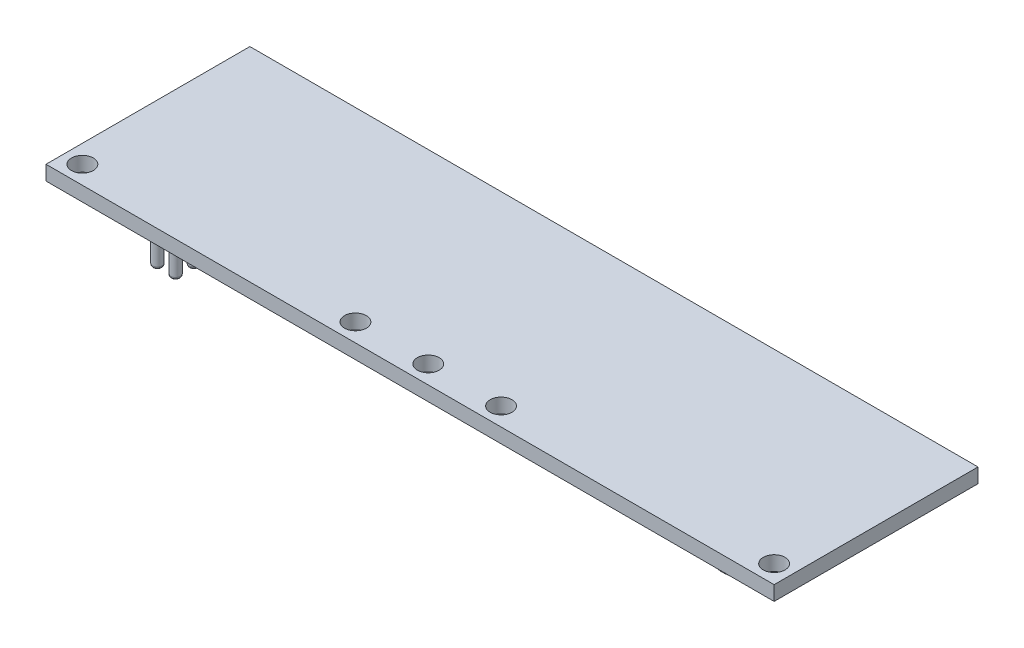
from build123d import *

# Parameters (mm, degrees)
SKETCH1_W              = 100
SKETCH1_H              = 28
BOARD_DEPTH            = 2
SCREW_HOLES_DEPTH      = 104.865297381
SCREW_HOLES_DEPTH_BACK = 104.865297381
SKETCH4_R              = 1.5
SKETCH6_W              = 5
SKETCH6_H              = 8
PIN_BASE_DEPTH         = 1.5
SKETCH7_R              = 0.65
PINS_DEPTH             = 10
PINS_2_DEPTH           = 10
PINS_3_DEPTH           = 10
PINS_4_DEPTH           = 10
PINS_5_DEPTH           = 10
PINS_6_DEPTH           = 10
FILLET1_R              = 0.4
FILLET2_R              = 0.4
FILLET3_R              = 0.4
FILLET4_R              = 0.4
FILLET5_R              = 0.4
FILLET6_R              = 0.4
GND_DEPTH              = 0.1
GND_2_DEPTH            = 0.1
GND_3_DEPTH            = 0.1
GND_4_DEPTH            = 0.1
GND_5_DEPTH            = 0.1
GND_6_DEPTH            = 0.1
EXTRUDE_5V_DEPTH       = 0.1
EXTRUDE_5V_2_DEPTH     = 0.1
EXTRUDE_5V_3_DEPTH     = 0.1
EXTRUDE_5V_4_DEPTH     = 0.1
SLC_SDA_DEPTH          = 0.1
SLC_SDA_2_DEPTH        = 0.1
SLC_SDA_3_DEPTH        = 0.1
SLC_SDA_4_DEPTH        = 0.1
SLC_SDA_5_DEPTH        = 0.1
SLC_SDA_6_DEPTH        = 0.1
SKETCH11_W             = 10
SKETCH11_H             = 10
BOSS_EXTRUDE7_DEPTH    = 5
SKETCH12_R             = 4.583408203
BOSS_EXTRUDE8_DEPTH    = 5


with BuildPart() as part:
    # Sketch1 → BOARD (new body)
    with BuildSketch(Plane(origin=(0, 0, 0), x_dir=(1, 0, 0), z_dir=(0, 1, 0))):
        with Locations((50, 14)):
            Rectangle(SKETCH1_W, SKETCH1_H)
    extrude(amount=BOARD_DEPTH)

    # Sketch4 → SCREW HOLES (cut, two sides: drawn at the far end of the back side and taken through both)
    with BuildSketch(Plane(origin=(0, 0, 0), x_dir=(1, 0, 0), z_dir=(0, 1, 0)).offset(-SCREW_HOLES_DEPTH_BACK)):
        with Locations(Location((2.5, 2.5, 0), (0, 0, 90))):
            Circle(SKETCH4_R)
        with Locations(Location((40, 2.5, 0), (0, 0, 90))):
            Circle(SKETCH4_R)
        with Locations(Location((50, 2.5, 0), (0, 0, 90))):
            Circle(SKETCH4_R)
        with Locations(Location((60, 2.5, 0), (0, 0, 90))):
            Circle(SKETCH4_R)
        with Locations(Location((97.5, 2.5, 0), (0, 0, 90))):
            Circle(SKETCH4_R)
    extrude(amount=SCREW_HOLES_DEPTH + SCREW_HOLES_DEPTH_BACK, mode=Mode.SUBTRACT)


with BuildPart() as body_2:
    # Sketch6 → PIN BASE (new body)
    with BuildSketch(Plane.XZ):
        with Locations((7.5, -11.5)):
            Rectangle(SKETCH6_W, SKETCH6_H)
    extrude(amount=PIN_BASE_DEPTH)


with BuildPart() as body_3:
    # Sketch7 → PINS (new body)
    with BuildSketch(Plane.XZ.offset(1.5)):
        with Locations(Location((6.3, -9, 0), (0, 0, 270))):
            Circle(SKETCH7_R)
    extrude(amount=PINS_DEPTH)

    # Fillet1
    fillet1_edges = [body_3.edges().sort_by_distance(p)[0] for p in [
        (6.3, -11.5, -8.35),
    ]]
    fillet(fillet1_edges, radius=FILLET1_R)


with BuildPart() as body_4:
    # Sketch7 → PINS 2 (new body)
    with BuildSketch(Plane.XZ.offset(1.5)):
        with Locations(Location((8.8, -9, 0), (0, 0, 270))):
            Circle(SKETCH7_R)
    extrude(amount=PINS_2_DEPTH)

    # Fillet3
    fillet3_edges = [body_4.edges().sort_by_distance(p)[0] for p in [
        (8.8, -11.5, -8.35),
    ]]
    fillet(fillet3_edges, radius=FILLET3_R)


with BuildPart() as body_5:
    # Sketch7 → PINS 3 (new body)
    with BuildSketch(Plane.XZ.offset(1.5)):
        with Locations(Location((8.8, -11.5, 0), (0, 0, 270))):
            Circle(SKETCH7_R)
    extrude(amount=PINS_3_DEPTH)

    # Fillet4
    fillet4_edges = [body_5.edges().sort_by_distance(p)[0] for p in [
        (8.8, -11.5, -10.85),
    ]]
    fillet(fillet4_edges, radius=FILLET4_R)


with BuildPart() as body_6:
    # Sketch7 → PINS 4 (new body)
    with BuildSketch(Plane.XZ.offset(1.5)):
        with Locations(Location((8.8, -14, 0), (0, 0, 270))):
            Circle(SKETCH7_R)
    extrude(amount=PINS_4_DEPTH)

    # Fillet6
    fillet6_edges = [body_6.edges().sort_by_distance(p)[0] for p in [
        (8.8, -11.5, -13.35),
    ]]
    fillet(fillet6_edges, radius=FILLET6_R)


with BuildPart() as body_7:
    # Sketch7 → PINS 5 (new body)
    with BuildSketch(Plane.XZ.offset(1.5)):
        with Locations(Location((6.3, -11.5, 0), (0, 0, 270))):
            Circle(SKETCH7_R)
    extrude(amount=PINS_5_DEPTH)

    # Fillet2
    fillet2_edges = [body_7.edges().sort_by_distance(p)[0] for p in [
        (6.3, -11.5, -10.85),
    ]]
    fillet(fillet2_edges, radius=FILLET2_R)


with BuildPart() as body_8:
    # Sketch7 → PINS 6 (new body)
    with BuildSketch(Plane.XZ.offset(1.5)):
        with Locations(Location((6.3, -14, 0), (0, 0, 270))):
            Circle(SKETCH7_R)
    extrude(amount=PINS_6_DEPTH)

    # Fillet5
    fillet5_edges = [body_8.edges().sort_by_distance(p)[0] for p in [
        (6.3, -11.5, -13.35),
    ]]
    fillet(fillet5_edges, radius=FILLET5_R)


with BuildPart() as body_9:
    # Sketch8 → gnd (new body)
    with BuildSketch(Plane.XZ):
        with BuildLine():
            Line((1.843758536, -6.912470807), (1.741995715, -7.008933481))
            add(Edge.make_bspline(
                [(1.741995715, -7.008933481), (1.723581135, -6.991610506), (1.687191082, -6.957377632), (1.627863847, -6.912961274), (1.565965093, -6.874911885), (1.50181781, -6.843953278), (1.437010559, -6.81925149), (1.372403551, -6.801664961), (1.308659491, -6.790449448), (1.266262953, -6.789108249), (1.24537195, -6.78844737)],
                knots=[0, 0, 0, 0, 1.08915593, 2.152340314, 3.188132944, 4.216796309, 5.218260357, 6.173443236, 7.099959455, 8, 8, 8, 8], degree=3))
            add(Edge.make_bspline(
                [(1.24537195, -6.78844737), (1.232553001, -6.788603703), (1.20694835, -6.788915964), (1.168915651, -6.792901426), (1.131281832, -6.798633384), (1.094117938, -6.806926891), (1.057351707, -6.817438053), (1.021111013, -6.83058613), (0.985328251, -6.845915047), (0.950340476, -6.863627946), (0.916420703, -6.883086103), (0.884384637, -6.904649093), (0.854028084, -6.927625808), (0.825921614, -6.952591505), (0.799903552, -6.979320041), (0.775354614, -7.007314207), (0.753138196, -7.037338828), (0.733071, -7.068841491), (0.715169435, -7.101268896), (0.69936676, -7.134308924), (0.686100896, -7.167851988), (0.675604703, -7.201940178), (0.666945022, -7.236309776), (0.66085295, -7.271198763), (0.657418385, -7.306644495), (0.65682429, -7.330380364), (0.65652563, -7.342312721)],
                knots=[0, 0, 0, 0, 1.02818874, 2.053710826, 3.065248034, 4.081641283, 5.106893873, 6.131558223, 7.173050175, 8.228653731, 9.27666206, 10.308777013, 11.325269123, 12.329503258, 13.32196095, 14.316845687, 15.314881793, 16.315733098, 17.311955233, 18.285320748, 19.252783886, 20.203351036, 21.145449891, 22.095197417, 23.042428769, 24, 24, 24, 24], degree=3))
            add(Edge.make_bspline(
                [(0.65652563, -7.342312721), (0.656811273, -7.354510322), (0.65738178, -7.378872215), (0.661033151, -7.415231284), (0.667809599, -7.45105035), (0.676868822, -7.486447115), (0.688200857, -7.521482199), (0.702326835, -7.556003714), (0.719058178, -7.590010379), (0.738424374, -7.623195788), (0.759661422, -7.655521455), (0.783452408, -7.685971036), (0.808724116, -7.714950008), (0.836397227, -7.741814955), (0.865584376, -7.767284463), (0.897157587, -7.790656818), (0.930496017, -7.812382218), (0.965650529, -7.832186855), (1.002239676, -7.849879367), (1.039756365, -7.865612208), (1.07832045, -7.878568982), (1.117729264, -7.88912892), (1.157935828, -7.897784687), (1.19914423, -7.903353214), (1.241051474, -7.907394093), (1.269300897, -7.907689546), (1.283533008, -7.907838395)],
                knots=[0, 0, 0, 0, 0.93586088, 1.869166235, 2.799637598, 3.729985548, 4.670839027, 5.622275134, 6.589130586, 7.576015415, 8.568469353, 9.55398029, 10.53834874, 11.515998671, 12.510579167, 13.508179873, 14.527009472, 15.561807829, 16.601455013, 17.643573243, 18.680854198, 19.719860599, 20.772568776, 21.833555941, 22.908541556, 24, 24, 24, 24], degree=3))
            add(Edge.make_bspline(
                [(1.283533008, -7.907838395), (1.300684943, -7.907479856), (1.334365553, -7.906775806), (1.38387531, -7.901295042), (1.431425876, -7.892735093), (1.476883637, -7.880199174), (1.520301392, -7.864209392), (1.561838307, -7.84493435), (1.601167357, -7.821634741), (1.63840677, -7.795337476), (1.672710826, -7.766038715), (1.703649736, -7.734423103), (1.730730025, -7.700644101), (1.754355313, -7.664900664), (1.773899953, -7.626896932), (1.789942319, -7.586819148), (1.802239129, -7.544649285), (1.807286991, -7.515510484), (1.809837595, -7.500787113)],
                knots=[0, 0, 0, 0, 1.13008108, 2.219097802, 3.278683437, 4.311054135, 5.322181354, 6.324827112, 7.324222904, 8.330512327, 9.32562643, 10.293043162, 11.24128371, 12.174520618, 13.111833804, 14.052305215, 15.015860969, 16, 16, 16, 16], degree=3))
            Line((1.809837595, -7.500787113), (1.368865373, -7.500787113))
            Line((1.368865373, -7.500787113), (1.368865373, -7.365103353))
            Line((1.368865373, -7.365103353), (1.928560886, -7.365103353))
            add(Edge.make_bspline(
                [(1.928560886, -7.365103353), (1.927916116, -7.39039279), (1.926654184, -7.439888788), (1.917802392, -7.512071004), (1.903508651, -7.580247209), (1.883982283, -7.644489204), (1.858705019, -7.704705949), (1.827948141, -7.760958583), (1.791219393, -7.812883697), (1.749827053, -7.860905195), (1.703373795, -7.903740939), (1.653114823, -7.941389612), (1.5989671, -7.973102803), (1.540981845, -7.998903708), (1.479348884, -8.01904001), (1.413925597, -8.033316767), (1.344800706, -8.041870354), (1.297426427, -8.042963227), (1.273197722, -8.043522156)],
                knots=[0, 0, 0, 0, 1.140356446, 2.231883559, 3.274166699, 4.278491846, 5.25512956, 6.21435461, 7.1637429, 8.11826594, 9.068280886, 10.0076534, 10.945064095, 11.891975133, 12.864533718, 13.863980011, 14.907571808, 16, 16, 16, 16], degree=3))
            add(Edge.make_bspline(
                [(1.273197722, -8.043522156), (1.258263831, -8.043307042), (1.228809386, -8.042882767), (1.185307756, -8.03986752), (1.14300556, -8.035225754), (1.101908961, -8.028216139), (1.06186679, -8.019630541), (1.02307903, -8.008636454), (0.985397925, -7.995910487), (0.948765234, -7.981435634), (0.913513456, -7.964664204), (0.879485576, -7.946026335), (0.846493499, -7.92561813), (0.814761958, -7.90308665), (0.784125618, -7.878600422), (0.754782025, -7.852110369), (0.726566905, -7.823697476), (0.708892563, -7.803521481), (0.699986834, -7.793355222)],
                knots=[0, 0, 0, 0, 1.107784379, 2.184907829, 3.233506516, 4.263428166, 5.276301166, 6.270063455, 7.25232949, 8.225834625, 9.190232166, 10.146266622, 11.1027726, 12.066435141, 13.031522626, 14.010570082, 14.99756817, 16, 16, 16, 16], degree=3))
            add(Edge.make_bspline(
                [(0.699986834, -7.793355222), (0.687065366, -7.777226732), (0.661436912, -7.745237466), (0.628447847, -7.693983916), (0.600325888, -7.640915355), (0.577508289, -7.585884052), (0.559691215, -7.528941481), (0.546913256, -7.470160404), (0.539426572, -7.409465127), (0.538348003, -7.368392244), (0.537802339, -7.347612868)],
                knots=[0, 0, 0, 0, 1.023165419, 2.029347347, 3.013907458, 3.994755782, 4.975994455, 5.96558838, 6.970761222, 8, 8, 8, 8], degree=3))
            add(Edge.make_bspline(
                [(0.537802339, -7.347612868), (0.538003512, -7.332053005), (0.538403302, -7.301131034), (0.543251042, -7.255223064), (0.55020634, -7.210130243), (0.560429482, -7.165889431), (0.573317059, -7.122471083), (0.589401263, -7.079855037), (0.608128054, -7.038016145), (0.629894001, -6.997242391), (0.654116401, -6.95807483), (0.680404728, -6.920671137), (0.709132279, -6.885712472), (0.739829918, -6.852756105), (0.772863899, -6.822216065), (0.807924753, -6.7938096), (0.845039498, -6.767498608), (0.8843249, -6.743697509), (0.92519459, -6.722317808), (0.967550602, -6.703574266), (1.011380008, -6.688083549), (1.056354441, -6.674939888), (1.10281433, -6.665220177), (1.150422524, -6.658171395), (1.199427179, -6.653348193), (1.232551512, -6.652960292), (1.249347061, -6.652763609)],
                knots=[0, 0, 0, 0, 1.008945113, 2.00506715, 2.99143336, 3.967273523, 4.948097931, 5.927297278, 6.919902385, 7.919676788, 8.923139349, 9.905703106, 10.883022732, 11.856032218, 12.825136022, 13.798837087, 14.781400844, 15.773989409, 16.776158564, 17.77167057, 18.775803737, 19.789618931, 20.80898985, 21.851988756, 22.910860228, 24, 24, 24, 24], degree=3))
            add(Edge.make_bspline(
                [(1.249347061, -6.652763609), (1.263044254, -6.652982643), (1.290204179, -6.653416962), (1.330619559, -6.656427409), (1.370410253, -6.661198936), (1.409635257, -6.667710251), (1.448160997, -6.676578967), (1.486097222, -6.68719189), (1.523498924, -6.699548621), (1.560248888, -6.714285477), (1.596594215, -6.731012293), (1.632736994, -6.749840581), (1.668553733, -6.771092294), (1.704106544, -6.794830535), (1.739619621, -6.820647601), (1.774531257, -6.849281876), (1.809684155, -6.879604168), (1.832287817, -6.90140666), (1.843758536, -6.912470807)],
                knots=[0, 0, 0, 0, 0.985871117, 1.954866573, 2.915460327, 3.869826059, 4.81536089, 5.759505086, 6.70452669, 7.649098992, 8.607881297, 9.583363685, 10.581137262, 11.603961102, 12.659522466, 13.73993555, 14.853081303, 16, 16, 16, 16], degree=3))
        make_face()
    extrude(amount=GND_DEPTH)


with BuildPart() as body_10:
    # Sketch8 → gnd 2 (new body)
    with BuildSketch(Plane.XZ):
        Polygon((2.199928407, -8.009601216), (2.199928407, -6.686684549), (2.224839098, -6.686684549), (3.098833322, -7.727898408), (3.098833322, -6.686684549), (3.217556612, -6.686684549), (3.217556612, -8.009601216), (3.190525863, -8.009601216), (2.318651698, -6.970772423), (2.318651698, -8.009601216), align=None)
    extrude(amount=GND_2_DEPTH)


with BuildPart() as body_11:
    # Sketch8 → gnd 3 (new body)
    with BuildSketch(Plane.XZ):
        with BuildLine():
            Line((3.556766014, -8.009601216), (3.556766014, -6.686684549))
            Line((3.556766014, -6.686684549), (3.823893418, -6.686684549))
            add(Edge.make_bspline(
                [(3.823893418, -6.686684549), (3.847127232, -6.68685183), (3.89201484, -6.687175016), (3.956880259, -6.689224173), (4.016896741, -6.692849141), (4.071866899, -6.698129289), (4.121941642, -6.704612727), (4.166980759, -6.712739368), (4.207217135, -6.722335492), (4.231963024, -6.730516957), (4.243665053, -6.734385871)],
                knots=[0, 0, 0, 0, 1.314313732, 2.53924729, 3.670748893, 4.714932338, 5.66265055, 6.526160246, 7.303039223, 8, 8, 8, 8], degree=3))
            add(Edge.make_bspline(
                [(4.243665053, -6.734385871), (4.2589711, -6.740218311), (4.289236104, -6.751750929), (4.332328082, -6.773505841), (4.372894514, -6.79815484), (4.411152941, -6.825730419), (4.446229444, -6.857013373), (4.479494333, -6.890674831), (4.509586803, -6.927938876), (4.537144403, -6.968032696), (4.561990917, -7.010483977), (4.583588158, -7.055211831), (4.601524638, -7.101989109), (4.61641434, -7.150685727), (4.628149161, -7.201408763), (4.636155427, -7.254217278), (4.641436129, -7.308902567), (4.641966827, -7.346010176), (4.6422361, -7.364838345)],
                knots=[0, 0, 0, 0, 0.984719456, 1.947108742, 2.898477687, 3.838006223, 4.779231079, 5.722358779, 6.681677486, 7.655904652, 8.64651281, 9.637519902, 10.640069247, 11.656948941, 12.698408672, 13.768548281, 14.867775369, 16, 16, 16, 16], degree=3))
            add(Edge.make_bspline(
                [(4.6422361, -7.364838345), (4.641998365, -7.381190064), (4.641529884, -7.413412832), (4.637323267, -7.460902099), (4.631209004, -7.506982526), (4.621742893, -7.551434681), (4.610251467, -7.594648025), (4.595523945, -7.636161998), (4.578652791, -7.676357426), (4.558979176, -7.714690817), (4.537381093, -7.751008045), (4.514202934, -7.785243438), (4.489469421, -7.816908477), (4.462944703, -7.846099053), (4.434971548, -7.872771162), (4.405366816, -7.897147608), (4.374054115, -7.918751425), (4.341173693, -7.938431552), (4.305766347, -7.955599365), (4.267161421, -7.970124994), (4.225194279, -7.982162256), (4.179967933, -7.992205422), (4.131404237, -8.000172141), (4.07945558, -8.005511581), (4.024201777, -8.009122362), (3.986260805, -8.009438499), (3.966732377, -8.009601216)],
                knots=[0, 0, 0, 0, 1.105936401, 2.179363191, 3.223086493, 4.248585256, 5.251745608, 6.245858792, 7.225916811, 8.198733463, 9.158002045, 10.082870192, 10.993790845, 11.873723703, 12.748670949, 13.606408763, 14.465103618, 15.319838547, 16.196477973, 17.123216899, 18.106603292, 19.147568657, 20.255746949, 21.433717677, 22.679120308, 24, 24, 24, 24], degree=3))
            Line((3.966732377, -8.009601216), (3.556766014, -8.009601216))
        make_face()
        with BuildLine():
            Line((3.675489305, -7.873917455), (3.827338514, -7.873917455))
            add(Edge.make_bspline(
                [(3.827338514, -7.873917455), (3.849158463, -7.873823681), (3.891126217, -7.873643318), (3.951473139, -7.872060655), (4.006612077, -7.869474565), (4.056550862, -7.865855414), (4.101261297, -7.861066979), (4.140836822, -7.855728102), (4.175147708, -7.849076685), (4.195909727, -7.843047602), (4.205503995, -7.840261522)],
                knots=[0, 0, 0, 0, 1.375205317, 2.645023457, 3.804390687, 4.853969522, 5.800190428, 6.637939096, 7.370582563, 8, 8, 8, 8], degree=3))
            add(Edge.make_bspline(
                [(4.205503995, -7.840261522), (4.217579715, -7.836008701), (4.241442727, -7.827604638), (4.275793614, -7.812274807), (4.307829743, -7.794116049), (4.338109425, -7.773931261), (4.366203132, -7.751008516), (4.392443795, -7.725846267), (4.416778583, -7.698316456), (4.438956074, -7.668453252), (4.458802963, -7.636442526), (4.475990005, -7.602598979), (4.491052935, -7.567293429), (4.502875498, -7.529983717), (4.512141805, -7.491003388), (4.518705244, -7.4503497), (4.522792952, -7.408030246), (4.52326975, -7.379246556), (4.523512809, -7.364573338)],
                knots=[0, 0, 0, 0, 0.998632004, 1.973411704, 2.929992603, 3.868527914, 4.809262121, 5.754881198, 6.702106254, 7.672490631, 8.653608572, 9.636854334, 10.631411391, 11.644891563, 12.686317036, 13.754757253, 14.855430412, 16, 16, 16, 16], degree=3))
            add(Edge.make_bspline(
                [(4.523512809, -7.364573338), (4.523318799, -7.349101457), (4.522937664, -7.31870681), (4.518147076, -7.274109137), (4.511146369, -7.231216153), (4.501022773, -7.190024989), (4.488122114, -7.150455285), (4.472022353, -7.112725887), (4.45362753, -7.076438332), (4.431741447, -7.042430164), (4.407771863, -7.010266995), (4.3811707, -6.980801893), (4.352360584, -6.953967738), (4.321655746, -6.929346628), (4.28819083, -6.907929108), (4.252754167, -6.888770749), (4.214825893, -6.872511767), (4.188438356, -6.863864101), (4.17502815, -6.859469338)],
                knots=[0, 0, 0, 0, 1.122418816, 2.205001699, 3.251619955, 4.274784885, 5.280384055, 6.268708349, 7.249350384, 8.229342522, 9.199999885, 10.157847722, 11.105861043, 12.055065948, 13.010012805, 13.98527497, 14.976112212, 16, 16, 16, 16], degree=3))
            add(Edge.make_bspline(
                [(4.17502815, -6.859469338), (4.163934116, -6.856401522), (4.140345155, -6.849878502), (4.101852262, -6.84276296), (4.058530464, -6.836486854), (4.010187423, -6.83117325), (3.956878243, -6.827360483), (3.898561927, -6.824498706), (3.835213266, -6.822568521), (3.791299035, -6.822436718), (3.768506883, -6.82236831)],
                knots=[0, 0, 0, 0, 0.674548936, 1.434276114, 2.292660221, 3.240891867, 4.284742987, 5.42552168, 6.663806718, 8, 8, 8, 8], degree=3))
            Line((3.768506883, -6.82236831), (3.675489305, -6.82236831))
            Line((3.675489305, -6.82236831), (3.675489305, -7.873917455))
        make_face(mode=Mode.SUBTRACT)
    extrude(amount=GND_3_DEPTH)


with BuildPart() as body_12:
    # Sketch8 → gnd 4 (new body)
    with BuildSketch(Plane.XZ):
        with BuildLine():
            Line((11.748673065, -6.912470807), (11.646910245, -7.008933481))
            add(Edge.make_bspline(
                [(11.646910245, -7.008933481), (11.628495665, -6.991610506), (11.592105612, -6.957377632), (11.532778377, -6.912961274), (11.470879623, -6.874911885), (11.40673234, -6.843953278), (11.341925089, -6.81925149), (11.277318081, -6.801664961), (11.213574021, -6.790449448), (11.171177483, -6.789108249), (11.15028648, -6.78844737)],
                knots=[0, 0, 0, 0, 1.08915593, 2.152340314, 3.188132944, 4.216796309, 5.218260357, 6.173443236, 7.099959455, 8, 8, 8, 8], degree=3))
            add(Edge.make_bspline(
                [(11.15028648, -6.78844737), (11.137467531, -6.788603703), (11.11186288, -6.788915964), (11.07383018, -6.792901426), (11.036196362, -6.798633384), (10.999032468, -6.806926891), (10.962266237, -6.817438053), (10.926025543, -6.83058613), (10.890242781, -6.845915047), (10.855255006, -6.863627946), (10.821335233, -6.883086103), (10.789299167, -6.904649093), (10.758942614, -6.927625808), (10.730836144, -6.952591505), (10.704818082, -6.979320041), (10.680269144, -7.007314207), (10.658052726, -7.037338828), (10.637985529, -7.068841491), (10.620083965, -7.101268896), (10.60428129, -7.134308924), (10.591015426, -7.167851988), (10.580519233, -7.201940178), (10.571859551, -7.236309776), (10.56576748, -7.271198763), (10.562332915, -7.306644495), (10.56173882, -7.330380364), (10.561440159, -7.342312721)],
                knots=[0, 0, 0, 0, 1.02818874, 2.053710826, 3.065248034, 4.081641283, 5.106893873, 6.131558223, 7.173050175, 8.228653731, 9.27666206, 10.308777013, 11.325269123, 12.329503258, 13.32196095, 14.316845687, 15.314881793, 16.315733098, 17.311955233, 18.285320748, 19.252783886, 20.203351036, 21.145449891, 22.095197417, 23.042428769, 24, 24, 24, 24], degree=3))
            add(Edge.make_bspline(
                [(10.561440159, -7.342312721), (10.561725803, -7.354510322), (10.56229631, -7.378872215), (10.565947681, -7.415231284), (10.572724129, -7.45105035), (10.581783352, -7.486447115), (10.593115387, -7.521482199), (10.607241365, -7.556003714), (10.623972708, -7.590010379), (10.643338904, -7.623195788), (10.664575952, -7.655521455), (10.688366937, -7.685971036), (10.713638646, -7.714950008), (10.741311757, -7.741814955), (10.770498905, -7.767284463), (10.802072117, -7.790656818), (10.835410547, -7.812382218), (10.870565059, -7.832186855), (10.907154206, -7.849879367), (10.944670895, -7.865612208), (10.98323498, -7.878568982), (11.022643794, -7.88912892), (11.062850358, -7.897784687), (11.10405876, -7.903353214), (11.145966004, -7.907394093), (11.174215427, -7.907689546), (11.188447538, -7.907838395)],
                knots=[0, 0, 0, 0, 0.93586088, 1.869166235, 2.799637598, 3.729985548, 4.670839027, 5.622275134, 6.589130586, 7.576015415, 8.568469353, 9.55398029, 10.53834874, 11.515998671, 12.510579167, 13.508179873, 14.527009472, 15.561807829, 16.601455013, 17.643573243, 18.680854198, 19.719860599, 20.772568776, 21.833555941, 22.908541556, 24, 24, 24, 24], degree=3))
            add(Edge.make_bspline(
                [(11.188447538, -7.907838395), (11.205599473, -7.907479856), (11.239280083, -7.906775806), (11.28878984, -7.901295042), (11.336340405, -7.892735093), (11.381798167, -7.880199174), (11.425215922, -7.864209392), (11.466752837, -7.84493435), (11.506081887, -7.821634741), (11.5433213, -7.795337476), (11.577625356, -7.766038715), (11.608564266, -7.734423103), (11.635644555, -7.700644101), (11.659269843, -7.664900664), (11.678814483, -7.626896932), (11.694856849, -7.586819148), (11.707153659, -7.544649285), (11.712201521, -7.515510484), (11.714752125, -7.500787113)],
                knots=[0, 0, 0, 0, 1.13008108, 2.219097802, 3.278683437, 4.311054135, 5.322181354, 6.324827112, 7.324222904, 8.330512327, 9.32562643, 10.293043162, 11.24128371, 12.174520618, 13.111833804, 14.052305215, 15.015860969, 16, 16, 16, 16], degree=3))
            Line((11.714752125, -7.500787113), (11.273779903, -7.500787113))
            Line((11.273779903, -7.500787113), (11.273779903, -7.365103353))
            Line((11.273779903, -7.365103353), (11.833475416, -7.365103353))
            add(Edge.make_bspline(
                [(11.833475416, -7.365103353), (11.832830646, -7.39039279), (11.831568714, -7.439888788), (11.822716922, -7.512071004), (11.808423181, -7.580247209), (11.788896813, -7.644489204), (11.763619549, -7.704705949), (11.732862671, -7.760958583), (11.696133923, -7.812883697), (11.654741583, -7.860905195), (11.608288325, -7.903740939), (11.558029353, -7.941389612), (11.50388163, -7.973102803), (11.445896375, -7.998903708), (11.384263414, -8.01904001), (11.318840127, -8.033316767), (11.249715236, -8.041870354), (11.202340957, -8.042963227), (11.178112252, -8.043522156)],
                knots=[0, 0, 0, 0, 1.140356446, 2.231883559, 3.274166699, 4.278491846, 5.25512956, 6.21435461, 7.1637429, 8.11826594, 9.068280886, 10.0076534, 10.945064095, 11.891975133, 12.864533718, 13.863980011, 14.907571808, 16, 16, 16, 16], degree=3))
            add(Edge.make_bspline(
                [(11.178112252, -8.043522156), (11.163178361, -8.043307042), (11.133723916, -8.042882767), (11.090222285, -8.03986752), (11.04792009, -8.035225754), (11.006823491, -8.028216139), (10.96678132, -8.019630541), (10.92799356, -8.008636454), (10.890312455, -7.995910487), (10.853679764, -7.981435634), (10.818427986, -7.964664204), (10.784400106, -7.946026335), (10.751408029, -7.92561813), (10.719676487, -7.90308665), (10.689040148, -7.878600422), (10.659696555, -7.852110369), (10.631481435, -7.823697476), (10.613807093, -7.803521481), (10.604901364, -7.793355222)],
                knots=[0, 0, 0, 0, 1.107784379, 2.184907829, 3.233506516, 4.263428166, 5.276301166, 6.270063455, 7.25232949, 8.225834625, 9.190232166, 10.146266622, 11.1027726, 12.066435141, 13.031522626, 14.010570082, 14.99756817, 16, 16, 16, 16], degree=3))
            add(Edge.make_bspline(
                [(10.604901364, -7.793355222), (10.591979896, -7.777226732), (10.566351442, -7.745237466), (10.533362377, -7.693983916), (10.505240418, -7.640915355), (10.482422819, -7.585884052), (10.464605744, -7.528941481), (10.451827786, -7.470160404), (10.444341102, -7.409465127), (10.443262533, -7.368392244), (10.442716869, -7.347612868)],
                knots=[0, 0, 0, 0, 1.023165419, 2.029347347, 3.013907458, 3.994755782, 4.975994455, 5.96558838, 6.970761222, 8, 8, 8, 8], degree=3))
            add(Edge.make_bspline(
                [(10.442716869, -7.347612868), (10.442918042, -7.332053005), (10.443317832, -7.301131034), (10.448165572, -7.255223064), (10.45512087, -7.210130243), (10.465344012, -7.165889431), (10.478231589, -7.122471083), (10.494315793, -7.079855037), (10.513042584, -7.038016145), (10.534808531, -6.997242391), (10.559030931, -6.95807483), (10.585319258, -6.920671137), (10.614046809, -6.885712472), (10.644744448, -6.852756105), (10.677778429, -6.822216065), (10.712839283, -6.7938096), (10.749954028, -6.767498608), (10.78923943, -6.743697509), (10.83010912, -6.722317808), (10.872465132, -6.703574266), (10.916294537, -6.688083549), (10.961268971, -6.674939888), (11.00772886, -6.665220177), (11.055337054, -6.658171395), (11.104341709, -6.653348193), (11.137466042, -6.652960292), (11.15426159, -6.652763609)],
                knots=[0, 0, 0, 0, 1.008945113, 2.00506715, 2.99143336, 3.967273523, 4.948097931, 5.927297278, 6.919902385, 7.919676788, 8.923139349, 9.905703106, 10.883022732, 11.856032218, 12.825136022, 13.798837087, 14.781400844, 15.773989409, 16.776158564, 17.77167057, 18.775803737, 19.789618931, 20.80898985, 21.851988756, 22.910860228, 24, 24, 24, 24], degree=3))
            add(Edge.make_bspline(
                [(11.15426159, -6.652763609), (11.167958784, -6.652982643), (11.195118708, -6.653416962), (11.235534089, -6.656427409), (11.275324782, -6.661198936), (11.314549787, -6.667710251), (11.353075527, -6.676578967), (11.391011752, -6.68719189), (11.428413454, -6.699548621), (11.465163417, -6.714285477), (11.501508745, -6.731012293), (11.537651524, -6.749840581), (11.573468262, -6.771092294), (11.609021074, -6.794830535), (11.644534151, -6.820647601), (11.679445787, -6.849281876), (11.714598685, -6.879604168), (11.737202347, -6.90140666), (11.748673065, -6.912470807)],
                knots=[0, 0, 0, 0, 0.985871117, 1.954866573, 2.915460327, 3.869826059, 4.81536089, 5.759505086, 6.70452669, 7.649098992, 8.607881297, 9.583363685, 10.581137262, 11.603961102, 12.659522466, 13.73993555, 14.853081303, 16, 16, 16, 16], degree=3))
        make_face()
    extrude(amount=GND_4_DEPTH)


with BuildPart() as body_13:
    # Sketch8 → gnd 5 (new body)
    with BuildSketch(Plane.XZ):
        Polygon((12.104842937, -8.009601216), (12.104842937, -6.686684549), (12.129753628, -6.686684549), (13.003747852, -7.727898408), (13.003747852, -6.686684549), (13.122471142, -6.686684549), (13.122471142, -8.009601216), (13.095440393, -8.009601216), (12.223566228, -6.970772423), (12.223566228, -8.009601216), align=None)
    extrude(amount=GND_5_DEPTH)


with BuildPart() as body_14:
    # Sketch8 → gnd 6 (new body)
    with BuildSketch(Plane.XZ):
        with BuildLine():
            Line((13.461680544, -8.009601216), (13.461680544, -6.686684549))
            Line((13.461680544, -6.686684549), (13.728807948, -6.686684549))
            add(Edge.make_bspline(
                [(13.728807948, -6.686684549), (13.752041762, -6.68685183), (13.79692937, -6.687175016), (13.861794789, -6.689224173), (13.92181127, -6.692849141), (13.976781428, -6.698129289), (14.026856172, -6.704612727), (14.071895289, -6.712739368), (14.112131665, -6.722335492), (14.136877554, -6.730516957), (14.148579583, -6.734385871)],
                knots=[0, 0, 0, 0, 1.314313732, 2.53924729, 3.670748893, 4.714932338, 5.66265055, 6.526160246, 7.303039223, 8, 8, 8, 8], degree=3))
            add(Edge.make_bspline(
                [(14.148579583, -6.734385871), (14.16388563, -6.740218311), (14.194150634, -6.751750929), (14.237242612, -6.773505841), (14.277809044, -6.79815484), (14.316067471, -6.825730419), (14.351143973, -6.857013373), (14.384408863, -6.890674831), (14.414501333, -6.927938876), (14.442058933, -6.968032696), (14.466905447, -7.010483977), (14.488502688, -7.055211831), (14.506439168, -7.101989109), (14.52132887, -7.150685727), (14.533063691, -7.201408763), (14.541069957, -7.254217278), (14.546350659, -7.308902567), (14.546881357, -7.346010176), (14.54715063, -7.364838345)],
                knots=[0, 0, 0, 0, 0.984719456, 1.947108742, 2.898477687, 3.838006223, 4.779231079, 5.722358779, 6.681677486, 7.655904652, 8.64651281, 9.637519902, 10.640069247, 11.656948941, 12.698408672, 13.768548281, 14.867775369, 16, 16, 16, 16], degree=3))
            add(Edge.make_bspline(
                [(14.54715063, -7.364838345), (14.546912895, -7.381190064), (14.546444414, -7.413412832), (14.542237797, -7.460902099), (14.536123533, -7.506982526), (14.526657423, -7.551434681), (14.515165997, -7.594648025), (14.500438475, -7.636161998), (14.483567321, -7.676357426), (14.463893706, -7.714690817), (14.442295623, -7.751008045), (14.419117464, -7.785243438), (14.394383951, -7.816908477), (14.367859233, -7.846099053), (14.339886078, -7.872771162), (14.310281346, -7.897147608), (14.278968645, -7.918751425), (14.246088223, -7.938431552), (14.210680877, -7.955599365), (14.172075951, -7.970124994), (14.130108809, -7.982162256), (14.084882462, -7.992205422), (14.036318767, -8.000172141), (13.98437011, -8.005511581), (13.929116307, -8.009122362), (13.891175335, -8.009438499), (13.871646907, -8.009601216)],
                knots=[0, 0, 0, 0, 1.105936401, 2.179363191, 3.223086493, 4.248585256, 5.251745608, 6.245858792, 7.225916811, 8.198733463, 9.158002045, 10.082870192, 10.993790845, 11.873723703, 12.748670949, 13.606408763, 14.465103618, 15.319838547, 16.196477973, 17.123216899, 18.106603292, 19.147568657, 20.255746949, 21.433717677, 22.679120308, 24, 24, 24, 24], degree=3))
            Line((13.871646907, -8.009601216), (13.461680544, -8.009601216))
        make_face()
        with BuildLine():
            Line((13.580403835, -7.873917455), (13.732253043, -7.873917455))
            add(Edge.make_bspline(
                [(13.732253043, -7.873917455), (13.754072993, -7.873823681), (13.796040747, -7.873643318), (13.856387669, -7.872060655), (13.911526607, -7.869474565), (13.961465392, -7.865855414), (14.006175827, -7.861066979), (14.045751351, -7.855728102), (14.080062238, -7.849076685), (14.100824257, -7.843047602), (14.110418525, -7.840261522)],
                knots=[0, 0, 0, 0, 1.375205317, 2.645023457, 3.804390687, 4.853969522, 5.800190428, 6.637939096, 7.370582563, 8, 8, 8, 8], degree=3))
            add(Edge.make_bspline(
                [(14.110418525, -7.840261522), (14.122494245, -7.836008701), (14.146357257, -7.827604638), (14.180708143, -7.812274807), (14.212744273, -7.794116049), (14.243023955, -7.773931261), (14.271117661, -7.751008516), (14.297358324, -7.725846267), (14.321693112, -7.698316456), (14.343870604, -7.668453252), (14.363717493, -7.636442526), (14.380904535, -7.602598979), (14.395967465, -7.567293429), (14.407790028, -7.529983717), (14.417056335, -7.491003388), (14.423619774, -7.4503497), (14.427707482, -7.408030246), (14.428184279, -7.379246556), (14.428427339, -7.364573338)],
                knots=[0, 0, 0, 0, 0.998632004, 1.973411704, 2.929992603, 3.868527914, 4.809262121, 5.754881198, 6.702106254, 7.672490631, 8.653608572, 9.636854334, 10.631411391, 11.644891563, 12.686317036, 13.754757253, 14.855430412, 16, 16, 16, 16], degree=3))
            add(Edge.make_bspline(
                [(14.428427339, -7.364573338), (14.428233329, -7.349101457), (14.427852193, -7.31870681), (14.423061606, -7.274109137), (14.416060899, -7.231216153), (14.405937303, -7.190024989), (14.393036644, -7.150455285), (14.376936883, -7.112725887), (14.35854206, -7.076438332), (14.336655977, -7.042430164), (14.312686393, -7.010266995), (14.28608523, -6.980801893), (14.257275114, -6.953967738), (14.226570275, -6.929346628), (14.19310536, -6.907929108), (14.157668697, -6.888770749), (14.119740423, -6.872511767), (14.093352886, -6.863864101), (14.07994268, -6.859469338)],
                knots=[0, 0, 0, 0, 1.122418816, 2.205001699, 3.251619955, 4.274784885, 5.280384055, 6.268708349, 7.249350384, 8.229342522, 9.199999885, 10.157847722, 11.105861043, 12.055065948, 13.010012805, 13.98527497, 14.976112212, 16, 16, 16, 16], degree=3))
            add(Edge.make_bspline(
                [(14.07994268, -6.859469338), (14.068848646, -6.856401522), (14.045259684, -6.849878502), (14.006766792, -6.84276296), (13.963444994, -6.836486854), (13.915101952, -6.83117325), (13.861792773, -6.827360483), (13.803476456, -6.824498706), (13.740127796, -6.822568521), (13.696213565, -6.822436718), (13.673421413, -6.82236831)],
                knots=[0, 0, 0, 0, 0.674548936, 1.434276114, 2.292660221, 3.240891867, 4.284742987, 5.42552168, 6.663806718, 8, 8, 8, 8], degree=3))
            Line((13.673421413, -6.82236831), (13.580403835, -6.82236831))
            Line((13.580403835, -6.82236831), (13.580403835, -7.873917455))
        make_face(mode=Mode.SUBTRACT)
    extrude(amount=GND_6_DEPTH)


with BuildPart() as body_15:
    # Sketch9 → 5v (new body)
    with BuildSketch(Plane.XZ):
        with BuildLine():
            Line((3.240251228, -9.43899117), (3.240251228, -9.574674931))
            Line((3.240251228, -9.574674931), (2.790268756, -9.574674931))
            Line((2.790268756, -9.574674931), (2.71898178, -9.922629575))
            add(Edge.make_bspline(
                [(2.71898178, -9.922629575), (2.732988018, -9.918762776), (2.76012289, -9.911271464), (2.800173194, -9.902953806), (2.838194652, -9.897939784), (2.862867188, -9.897255152), (2.874806099, -9.896923862)],
                knots=[0, 0, 0, 0, 1.100273476, 2.13160584, 3.095893838, 4, 4, 4, 4], degree=3))
            add(Edge.make_bspline(
                [(2.874806099, -9.896923862), (2.889578822, -9.897243606), (2.918625686, -9.897872302), (2.961124931, -9.90390928), (3.001694209, -9.91341157), (3.040248677, -9.926686291), (3.076859659, -9.9436611), (3.111190314, -9.964865542), (3.143755954, -9.989635581), (3.173972351, -10.018114202), (3.201384813, -10.049456598), (3.225486839, -10.083156151), (3.245959008, -10.118885356), (3.262423936, -10.156985587), (3.275571587, -10.197035624), (3.284322489, -10.239456868), (3.290149638, -10.283849461), (3.290800659, -10.314202676), (3.291132638, -10.329680857)],
                knots=[0, 0, 0, 0, 1.052922333, 2.070308379, 3.05430497, 4.020497103, 4.973039431, 5.925935799, 6.892292201, 7.88610001, 8.88166317, 9.857072816, 10.836096531, 11.812156883, 12.81219415, 13.836441305, 14.89672472, 16, 16, 16, 16], degree=3))
            add(Edge.make_bspline(
                [(3.291132638, -10.329680857), (3.290881255, -10.340461577), (3.290381887, -10.361877325), (3.287842421, -10.39368183), (3.282953029, -10.42481302), (3.276388442, -10.455275025), (3.267867945, -10.485010174), (3.257553332, -10.514103579), (3.244930429, -10.54237416), (3.231084641, -10.570089413), (3.215494455, -10.596622778), (3.198191269, -10.621436532), (3.179910265, -10.644902912), (3.16023986, -10.666770245), (3.138997222, -10.686894838), (3.116439616, -10.705396123), (3.09274704, -10.722586983), (3.067552946, -10.737769605), (3.041418734, -10.751740722), (3.013966997, -10.763202297), (2.985822625, -10.773449431), (2.956580544, -10.781617318), (2.92630699, -10.788017421), (2.89495206, -10.792364374), (2.862680199, -10.795530468), (2.840804822, -10.795728662), (2.82975485, -10.795828777)],
                knots=[0, 0, 0, 0, 1.056347294, 2.098418968, 3.122841568, 4.141288669, 5.149314143, 6.15115421, 7.162517403, 8.180376062, 9.185164535, 10.17417709, 11.141909838, 12.097768115, 13.052685741, 14.0056014, 14.954263652, 15.917497458, 16.885230207, 17.854509472, 18.828990115, 19.81800267, 20.826176721, 21.857883937, 22.917946725, 24, 24, 24, 24], degree=3))
            add(Edge.make_bspline(
                [(2.82975485, -10.795828777), (2.81657324, -10.795567656), (2.79063998, -10.795053933), (2.752645599, -10.789679684), (2.716089781, -10.781982609), (2.681266796, -10.770402828), (2.647864562, -10.755893345), (2.616332761, -10.737555387), (2.585865697, -10.716774595), (2.557701921, -10.692251366), (2.531562557, -10.665446927), (2.508163371, -10.636358771), (2.487324191, -10.605466988), (2.469378733, -10.572621554), (2.454071446, -10.537908776), (2.442046137, -10.501198594), (2.432340331, -10.462682819), (2.428234216, -10.436166463), (2.426148664, -10.422698435)],
                knots=[0, 0, 0, 0, 1.0467383, 2.05933395, 3.04377827, 4.011590433, 4.970194871, 5.932262533, 6.905835911, 7.896367577, 8.894135286, 9.877477877, 10.858688626, 11.851381753, 12.8477658, 13.868841284, 14.917554742, 16, 16, 16, 16], degree=3))
            Line((2.426148664, -10.422698435), (2.544871954, -10.422698435))
            add(Edge.make_bspline(
                [(2.544871954, -10.422698435), (2.547793165, -10.435313939), (2.553407894, -10.459561639), (2.565732091, -10.49362914), (2.580800442, -10.523987894), (2.598718158, -10.551039493), (2.620092723, -10.574628608), (2.64448331, -10.595650533), (2.671829027, -10.614615537), (2.702215754, -10.630423547), (2.734273078, -10.643905487), (2.76782497, -10.652883062), (2.801957863, -10.659195602), (2.825044033, -10.659827488), (2.836645041, -10.660145016)],
                knots=[0, 0, 0, 0, 1.136247022, 2.183929868, 3.172523383, 4.106158343, 5.02341133, 5.958108904, 6.928429099, 7.938127109, 8.96079061, 9.975095812, 10.982467395, 12, 12, 12, 12], degree=3))
            add(Edge.make_bspline(
                [(2.836645041, -10.660145016), (2.84796862, -10.659834782), (2.870264839, -10.659223927), (2.903077476, -10.654522277), (2.934756747, -10.647281171), (2.964990064, -10.636444649), (2.994306479, -10.623274175), (3.021964422, -10.606372941), (3.048764021, -10.586922279), (3.073872274, -10.564638076), (3.096868137, -10.540081079), (3.117186671, -10.513820278), (3.134111278, -10.485805875), (3.148373873, -10.456522868), (3.159204138, -10.425650318), (3.166930342, -10.393332909), (3.171467212, -10.359490819), (3.172091319, -10.336408074), (3.172409347, -10.324645717)],
                knots=[0, 0, 0, 0, 1.027316725, 2.022795036, 3.002884548, 3.971462791, 4.93288096, 5.914575861, 6.907176829, 7.935150275, 8.956128384, 9.956726525, 10.942570165, 11.921478529, 12.907843606, 13.90538589, 14.932640048, 16, 16, 16, 16], degree=3))
            add(Edge.make_bspline(
                [(3.172409347, -10.324645717), (3.172160458, -10.314033752), (3.171673292, -10.293262339), (3.167692987, -10.262873353), (3.160769608, -10.234119554), (3.151159986, -10.206862091), (3.138959101, -10.181075254), (3.124049334, -10.156732431), (3.106150877, -10.134154464), (3.085705431, -10.11333079), (3.063307303, -10.094112638), (3.038571126, -10.077729606), (3.012014547, -10.063947113), (2.983957525, -10.052052959), (2.953732698, -10.043510415), (2.921938613, -10.037096958), (2.888231941, -10.033386985), (2.865186473, -10.032872224), (2.853340504, -10.032607623)],
                knots=[0, 0, 0, 0, 1.045622112, 2.046656509, 3.013763289, 3.955457236, 4.890082067, 5.820317437, 6.762574623, 7.722996705, 8.69280354, 9.665887285, 10.63943826, 11.638615906, 12.663482002, 13.728887084, 14.832589034, 16, 16, 16, 16], degree=3))
            add(Edge.make_bspline(
                [(2.853340504, -10.032607623), (2.843086415, -10.032827073), (2.821914322, -10.03328018), (2.789437539, -10.036616386), (2.755309418, -10.0419985), (2.719660784, -10.049401636), (2.68238458, -10.059089572), (2.64355947, -10.070698922), (2.603103822, -10.084578963), (2.575845039, -10.09506108), (2.561832424, -10.100449503)],
                knots=[0, 0, 0, 0, 0.817624296, 1.688186739, 2.600797293, 3.572016777, 4.590301741, 5.671205678, 6.80286297, 8, 8, 8, 8], degree=3))
            Line((2.561832424, -10.100449503), (2.697516185, -9.43899117))
            Line((2.697516185, -9.43899117), (3.240251228, -9.43899117))
        make_face()
    extrude(amount=EXTRUDE_5V_DEPTH)


with BuildPart() as body_16:
    # Sketch9 → Extrude 5v 2 (new body)
    with BuildSketch(Plane.XZ):
        Polygon((3.443776869, -9.43899117), (3.570980394, -9.43899117), (4.011952617, -10.481530066), (4.452924839, -9.43899117), (4.580128364, -9.43899117), (4.020432852, -10.761907837), (4.003472382, -10.761907837), align=None)
    extrude(amount=EXTRUDE_5V_2_DEPTH)


with BuildPart() as body_17:
    # Sketch9 → Extrude 5v 3 (new body)
    with BuildSketch(Plane.XZ):
        with BuildLine():
            Line((11.63568392, -9.43899117), (11.63568392, -9.574674931))
            Line((11.63568392, -9.574674931), (11.185701448, -9.574674931))
            Line((11.185701448, -9.574674931), (11.114414472, -9.922629575))
            add(Edge.make_bspline(
                [(11.114414472, -9.922629575), (11.128420711, -9.918762776), (11.155555582, -9.911271464), (11.195605886, -9.902953806), (11.233627344, -9.897939784), (11.25829988, -9.897255152), (11.270238791, -9.896923862)],
                knots=[0, 0, 0, 0, 1.100273476, 2.13160584, 3.095893838, 4, 4, 4, 4], degree=3))
            add(Edge.make_bspline(
                [(11.270238791, -9.896923862), (11.285011514, -9.897243606), (11.314058379, -9.897872302), (11.356557624, -9.90390928), (11.397126902, -9.91341157), (11.435681369, -9.926686291), (11.472292351, -9.9436611), (11.506623007, -9.964865542), (11.539188646, -9.989635581), (11.569405043, -10.018114202), (11.596817505, -10.049456598), (11.620919531, -10.083156151), (11.641391701, -10.118885356), (11.657856629, -10.156985587), (11.671004279, -10.197035624), (11.679755182, -10.239456868), (11.685582331, -10.283849461), (11.686233352, -10.314202676), (11.68656533, -10.329680857)],
                knots=[0, 0, 0, 0, 1.052922333, 2.070308379, 3.05430497, 4.020497103, 4.973039431, 5.925935799, 6.892292201, 7.88610001, 8.88166317, 9.857072816, 10.836096531, 11.812156883, 12.81219415, 13.836441305, 14.89672472, 16, 16, 16, 16], degree=3))
            add(Edge.make_bspline(
                [(11.68656533, -10.329680857), (11.686313948, -10.340461577), (11.68581458, -10.361877325), (11.683275114, -10.39368183), (11.678385721, -10.42481302), (11.671821135, -10.455275025), (11.663300637, -10.485010174), (11.652986025, -10.514103579), (11.640363121, -10.54237416), (11.626517334, -10.570089413), (11.610927147, -10.596622778), (11.593623961, -10.621436532), (11.575342957, -10.644902912), (11.555672553, -10.666770245), (11.534429915, -10.686894838), (11.511872308, -10.705396123), (11.488179733, -10.722586983), (11.462985638, -10.737769605), (11.436851426, -10.751740722), (11.409399689, -10.763202297), (11.381255317, -10.773449431), (11.352013236, -10.781617318), (11.321739682, -10.788017421), (11.290384752, -10.792364374), (11.258112892, -10.795530468), (11.236237515, -10.795728662), (11.225187543, -10.795828777)],
                knots=[0, 0, 0, 0, 1.056347294, 2.098418968, 3.122841568, 4.141288669, 5.149314143, 6.15115421, 7.162517403, 8.180376062, 9.185164535, 10.17417709, 11.141909838, 12.097768115, 13.052685741, 14.0056014, 14.954263652, 15.917497458, 16.885230207, 17.854509472, 18.828990115, 19.81800267, 20.826176721, 21.857883937, 22.917946725, 24, 24, 24, 24], degree=3))
            add(Edge.make_bspline(
                [(11.225187543, -10.795828777), (11.212005933, -10.795567656), (11.186072672, -10.795053933), (11.148078291, -10.789679684), (11.111522473, -10.781982609), (11.076699488, -10.770402828), (11.043297255, -10.755893345), (11.011765454, -10.737555387), (10.981298389, -10.716774595), (10.953134614, -10.692251366), (10.926995249, -10.665446927), (10.903596063, -10.636358771), (10.882756884, -10.605466988), (10.864811426, -10.572621554), (10.849504138, -10.537908776), (10.83747883, -10.501198594), (10.827773023, -10.462682819), (10.823666909, -10.436166463), (10.821581356, -10.422698435)],
                knots=[0, 0, 0, 0, 1.0467383, 2.05933395, 3.04377827, 4.011590433, 4.970194871, 5.932262533, 6.905835911, 7.896367577, 8.894135286, 9.877477877, 10.858688626, 11.851381753, 12.8477658, 13.868841284, 14.917554742, 16, 16, 16, 16], degree=3))
            Line((10.821581356, -10.422698435), (10.940304647, -10.422698435))
            add(Edge.make_bspline(
                [(10.940304647, -10.422698435), (10.943225857, -10.435313939), (10.948840586, -10.459561639), (10.961164783, -10.49362914), (10.976233135, -10.523987894), (10.99415085, -10.551039493), (11.015525415, -10.574628608), (11.039916003, -10.595650533), (11.067261719, -10.614615537), (11.097648446, -10.630423547), (11.129705771, -10.643905487), (11.163257663, -10.652883062), (11.197390555, -10.659195602), (11.220476725, -10.659827488), (11.232077733, -10.660145016)],
                knots=[0, 0, 0, 0, 1.136247022, 2.183929868, 3.172523383, 4.106158343, 5.02341133, 5.958108904, 6.928429099, 7.938127109, 8.96079061, 9.975095812, 10.982467395, 12, 12, 12, 12], degree=3))
            add(Edge.make_bspline(
                [(11.232077733, -10.660145016), (11.243401312, -10.659834782), (11.265697531, -10.659223927), (11.298510169, -10.654522277), (11.330189439, -10.647281171), (11.360422756, -10.636444649), (11.389739171, -10.623274175), (11.417397114, -10.606372941), (11.444196713, -10.586922279), (11.469304966, -10.564638076), (11.49230083, -10.540081079), (11.512619363, -10.513820278), (11.529543971, -10.485805875), (11.543806565, -10.456522868), (11.55463683, -10.425650318), (11.562363034, -10.393332909), (11.566899905, -10.359490819), (11.567524011, -10.336408074), (11.56784204, -10.324645717)],
                knots=[0, 0, 0, 0, 1.027316725, 2.022795036, 3.002884548, 3.971462791, 4.93288096, 5.914575861, 6.907176829, 7.935150275, 8.956128384, 9.956726525, 10.942570165, 11.921478529, 12.907843606, 13.90538589, 14.932640048, 16, 16, 16, 16], degree=3))
            add(Edge.make_bspline(
                [(11.56784204, -10.324645717), (11.56759315, -10.314033752), (11.567105984, -10.293262339), (11.563125679, -10.262873353), (11.5562023, -10.234119554), (11.546592679, -10.206862091), (11.534391793, -10.181075254), (11.519482026, -10.156732431), (11.50158357, -10.134154464), (11.481138124, -10.11333079), (11.458739995, -10.094112638), (11.434003818, -10.077729606), (11.407447239, -10.063947113), (11.379390218, -10.052052959), (11.34916539, -10.043510415), (11.317371306, -10.037096958), (11.283664633, -10.033386985), (11.260619165, -10.032872224), (11.248773196, -10.032607623)],
                knots=[0, 0, 0, 0, 1.045622112, 2.046656509, 3.013763289, 3.955457236, 4.890082067, 5.820317437, 6.762574623, 7.722996705, 8.69280354, 9.665887285, 10.63943826, 11.638615906, 12.663482002, 13.728887084, 14.832589034, 16, 16, 16, 16], degree=3))
            add(Edge.make_bspline(
                [(11.248773196, -10.032607623), (11.238519107, -10.032827073), (11.217347014, -10.03328018), (11.184870232, -10.036616386), (11.15074211, -10.0419985), (11.115093476, -10.049401636), (11.077817273, -10.059089572), (11.038992163, -10.070698922), (10.998536514, -10.084578963), (10.971277732, -10.09506108), (10.957265117, -10.100449503)],
                knots=[0, 0, 0, 0, 0.817624296, 1.688186739, 2.600797293, 3.572016777, 4.590301741, 5.671205678, 6.80286297, 8, 8, 8, 8], degree=3))
            Line((10.957265117, -10.100449503), (11.092948877, -9.43899117))
            Line((11.092948877, -9.43899117), (11.63568392, -9.43899117))
        make_face()
    extrude(amount=EXTRUDE_5V_3_DEPTH)


with BuildPart() as body_18:
    # Sketch9 → Extrude 5v 4 (new body)
    with BuildSketch(Plane.XZ):
        Polygon((11.839209561, -9.43899117), (11.966413087, -9.43899117), (12.407385309, -10.481530066), (12.848357531, -9.43899117), (12.975561057, -9.43899117), (12.415865544, -10.761907837), (12.398905074, -10.761907837), align=None)
    extrude(amount=EXTRUDE_5V_4_DEPTH)


with BuildPart() as body_19:
    # Sketch10 → SLC & SDA (new body)
    with BuildSketch(Plane.XZ):
        with BuildLine():
            Line((1.573182016, -12.854636791), (1.685015116, -12.787589933))
            add(Edge.make_bspline(
                [(1.685015116, -12.787589933), (1.695416354, -12.805001174), (1.715344726, -12.838360439), (1.748588245, -12.883437139), (1.783034316, -12.921749621), (1.818938022, -12.953075005), (1.856080211, -12.977737531), (1.894703351, -12.995200874), (1.934677285, -13.006092627), (1.961881676, -13.007415576), (1.975463166, -13.008076044)],
                knots=[0, 0, 0, 0, 1.272034388, 2.437168799, 3.508375237, 4.49857839, 5.41946034, 6.295179144, 7.148887113, 8, 8, 8, 8], degree=3))
            add(Edge.make_bspline(
                [(1.975463166, -13.008076044), (1.987062069, -13.007752998), (2.01005692, -13.007112559), (2.043909316, -13.000958803), (2.076786366, -12.991504814), (2.108010464, -12.977965355), (2.137150771, -12.961584439), (2.162704492, -12.94179883), (2.184795731, -12.91964708), (2.202866438, -12.894933993), (2.216730618, -12.868355785), (2.227386549, -12.841074994), (2.233300014, -12.812663065), (2.234190811, -12.793533515), (2.234640349, -12.78387983)],
                knots=[0, 0, 0, 0, 1.095163259, 2.171163733, 3.241058638, 4.321873601, 5.38011039, 6.391990106, 7.366004449, 8.327778327, 9.272591725, 10.192022065, 11.087607919, 12, 12, 12, 12], degree=3))
            add(Edge.make_bspline(
                [(2.234640349, -12.78387983), (2.234083095, -12.772865283), (2.232950278, -12.750474317), (2.223375582, -12.71743933), (2.208313516, -12.684747197), (2.194418112, -12.664524993), (2.187204035, -12.654026231)],
                knots=[0, 0, 0, 0, 0.938893495, 1.908633276, 2.914225137, 4, 4, 4, 4], degree=3))
            add(Edge.make_bspline(
                [(2.187204035, -12.654026231), (2.181280916, -12.646449009), (2.168846068, -12.630541579), (2.147468675, -12.606863172), (2.122383864, -12.582438948), (2.09445008, -12.556336269), (2.062649775, -12.529769155), (2.027978959, -12.501470728), (1.989552441, -12.472517156), (1.962602929, -12.45309955), (1.948697424, -12.443080384)],
                knots=[0, 0, 0, 0, 0.722233717, 1.516239348, 2.393582979, 3.351407094, 4.387010283, 5.505090956, 6.712668013, 8, 8, 8, 8], degree=3))
            add(Edge.make_bspline(
                [(1.948697424, -12.443080384), (1.93477883, -12.433166603), (1.908167539, -12.414212207), (1.870952539, -12.3860816), (1.837673828, -12.360362637), (1.808479319, -12.336813204), (1.783381852, -12.315430106), (1.762183658, -12.296418683), (1.745424739, -12.279264778), (1.736105517, -12.268136651), (1.731921416, -12.263140397)],
                knots=[0, 0, 0, 0, 1.452282411, 2.77665338, 3.964542531, 5.026858415, 5.96415736, 6.766646006, 7.446254459, 8, 8, 8, 8], degree=3))
            add(Edge.make_bspline(
                [(1.731921416, -12.263140397), (1.726073162, -12.255353696), (1.714571786, -12.240040102), (1.699389993, -12.216104814), (1.686486202, -12.191603163), (1.676370678, -12.166469309), (1.667852523, -12.141056107), (1.662123186, -12.115031975), (1.658535664, -12.088513688), (1.658168277, -12.070668109), (1.657984367, -12.061734815)],
                knots=[0, 0, 0, 0, 1.068054152, 2.10047183, 3.106115577, 4.101338837, 5.06977816, 6.043150881, 7.020423561, 8, 8, 8, 8], degree=3))
            add(Edge.make_bspline(
                [(1.657984367, -12.061734815), (1.658477704, -12.047738442), (1.659453836, -12.020044858), (1.667709031, -11.979589752), (1.680738964, -11.94096572), (1.698993282, -11.904555147), (1.722525079, -11.871306101), (1.749756742, -11.840836122), (1.78219144, -11.815221212), (1.81777889, -11.792840463), (1.856731745, -11.775322807), (1.897549736, -11.762108389), (1.940297736, -11.754620961), (1.969251897, -11.753546464), (1.983943401, -11.753001258)],
                knots=[0, 0, 0, 0, 1.005424448, 1.989358655, 2.955360095, 3.929531133, 4.905563448, 5.876582895, 6.856512386, 7.866279853, 8.892233794, 9.918561126, 10.94386622, 12, 12, 12, 12], degree=3))
            add(Edge.make_bspline(
                [(1.983943401, -11.753001258), (1.999532689, -11.753538948), (2.030534807, -11.754608243), (2.076137338, -11.763905525), (2.120043323, -11.779289409), (2.155362652, -11.796747622), (2.183005095, -11.814184199), (2.20408586, -11.830066692), (2.225448111, -11.848351332), (2.247264161, -11.86908682), (2.269164351, -11.89246342), (2.29147381, -11.918321031), (2.31424471, -11.946501634), (2.328893502, -11.966619228), (2.33640317, -11.976932464)],
                knots=[0, 0, 0, 0, 1.286793592, 2.559021753, 3.825965368, 5.121522368, 5.803751409, 6.523245864, 7.299691795, 8.125521123, 9.008227632, 9.944561021, 10.946284179, 12, 12, 12, 12], degree=3))
            Line((2.33640317, -11.976932464), (2.229075195, -12.058289719))
            add(Edge.make_bspline(
                [(2.229075195, -12.058289719), (2.222594441, -12.04994072), (2.210114024, -12.0338625), (2.191166271, -12.011345961), (2.173307407, -11.990777827), (2.155712464, -11.972912734), (2.139310705, -11.956772345), (2.123391466, -11.942953627), (2.108183839, -11.931321185), (2.089014054, -11.918907101), (2.064930274, -11.906601518), (2.034698023, -11.896188622), (2.003104402, -11.889931203), (1.981586356, -11.889103856), (1.970693034, -11.888685018)],
                knots=[0, 0, 0, 0, 1.181633172, 2.275549214, 3.290209073, 4.226197932, 5.078386478, 5.862611352, 6.581680152, 7.217281963, 8.414376989, 9.595101626, 10.782541182, 12, 12, 12, 12], degree=3))
            add(Edge.make_bspline(
                [(1.970693034, -11.888685018), (1.957026729, -11.889143012), (1.930672548, -11.89002621), (1.893256596, -11.899672157), (1.859581213, -11.914859943), (1.830646166, -11.936145664), (1.806555107, -11.961364611), (1.789128341, -11.99038519), (1.77863944, -12.022430919), (1.777359506, -12.044785057), (1.776707657, -12.05616966)],
                knots=[0, 0, 0, 0, 1.14458467, 2.207223713, 3.21896685, 4.227309161, 5.202851033, 6.127160689, 7.046193047, 8, 8, 8, 8], degree=3))
            add(Edge.make_bspline(
                [(1.776707657, -12.05616966), (1.77685625, -12.063257273), (1.777153678, -12.077444087), (1.78130189, -12.098403405), (1.7866311, -12.119309774), (1.795076083, -12.140069203), (1.806734874, -12.161044749), (1.822044866, -12.182597608), (1.841326683, -12.204917748), (1.856096863, -12.219434821), (1.863895074, -12.227099398)],
                knots=[0, 0, 0, 0, 0.858281714, 1.717966888, 2.583508476, 3.4729293, 4.427298488, 5.488583878, 6.674047936, 8, 8, 8, 8], degree=3))
            add(Edge.make_bspline(
                [(1.863895074, -12.227099398), (1.86679089, -12.229683631), (1.873670687, -12.235823177), (1.886248194, -12.245874426), (1.902857526, -12.258273093), (1.923064965, -12.273614132), (1.947243105, -12.291409804), (1.975394604, -12.311432568), (2.007205659, -12.334332429), (2.029779121, -12.350342571), (2.041715002, -12.358808049)],
                knots=[0, 0, 0, 0, 0.420754252, 0.999615792, 1.744751191, 2.668019286, 3.750313428, 4.999500688, 6.413464383, 8, 8, 8, 8], degree=3))
            add(Edge.make_bspline(
                [(2.041715002, -12.358808049), (2.056072773, -12.369255824), (2.083874606, -12.389486494), (2.12343268, -12.419881706), (2.15930028, -12.44960869), (2.191603336, -12.478477607), (2.220660977, -12.506269476), (2.24615083, -12.533318654), (2.268332619, -12.559431356), (2.29221286, -12.59290968), (2.316614178, -12.63402634), (2.337569748, -12.684402341), (2.350783171, -12.734974165), (2.352511095, -12.768964368), (2.35336364, -12.785734881)],
                knots=[0, 0, 0, 0, 1.163667725, 2.253281268, 3.268753668, 4.215851969, 5.092017293, 5.902905408, 6.650798638, 7.335211899, 8.59617414, 9.77448103, 10.901945474, 12, 12, 12, 12], degree=3))
            add(Edge.make_bspline(
                [(2.35336364, -12.785734881), (2.353115257, -12.797595156), (2.352623316, -12.821085388), (2.346968447, -12.855577634), (2.338683335, -12.889077992), (2.326196047, -12.921172371), (2.310954853, -12.952447921), (2.29161523, -12.982084241), (2.269198337, -13.010737255), (2.243483194, -13.03764292), (2.215344415, -13.062342226), (2.185603852, -13.084313627), (2.154212826, -13.102633499), (2.121341629, -13.117582776), (2.08698271, -13.129274909), (2.051147625, -13.13774644), (2.013777304, -13.142945771), (1.988377122, -13.143485431), (1.975463166, -13.143759805)],
                knots=[0, 0, 0, 0, 0.983748083, 1.948392443, 2.894712957, 3.844097841, 4.80183111, 5.778335162, 6.776009319, 7.81870978, 8.863265674, 9.881300176, 10.883814829, 11.87499822, 12.874611388, 13.892143829, 14.928324115, 16, 16, 16, 16], degree=3))
            add(Edge.make_bspline(
                [(1.975463166, -13.143759805), (1.965471236, -13.14356659), (1.945613213, -13.143182595), (1.916240879, -13.139787884), (1.887461927, -13.134984902), (1.859637482, -13.127359584), (1.832409055, -13.118107869), (1.805895071, -13.106716297), (1.780082678, -13.093064855), (1.754827223, -13.077456319), (1.730192937, -13.059291636), (1.706410876, -13.038134987), (1.682700737, -13.01456987), (1.659762346, -12.987956354), (1.637131723, -12.9587244), (1.615255063, -12.926600512), (1.593679532, -12.891759667), (1.580142138, -12.867242209), (1.573182016, -12.854636791)],
                knots=[0, 0, 0, 0, 0.915332311, 1.819136955, 2.706846663, 3.586547465, 4.459518054, 5.340707479, 6.227863349, 7.133153174, 8.059268498, 9.028702269, 10.047606654, 11.120612155, 12.245963614, 13.433783089, 14.680604001, 16, 16, 16, 16], degree=3))
        make_face()
    extrude(amount=SLC_SDA_DEPTH)


with BuildPart() as body_20:
    # Sketch10 → SLC _ SDA 2 (new body)
    with BuildSketch(Plane.XZ):
        with BuildLine():
            Line((3.845885008, -12.029668926), (3.742002128, -12.109171129))
            add(Edge.make_bspline(
                [(3.742002128, -12.109171129), (3.734591569, -12.100339349), (3.719870362, -12.08279486), (3.696186675, -12.058158544), (3.671504209, -12.035077329), (3.645832398, -12.013441262), (3.618709159, -11.994006949), (3.590791536, -11.975761621), (3.561612513, -11.959407446), (3.521262899, -11.939577687), (3.468479337, -11.918884943), (3.402033074, -11.901534615), (3.332670248, -11.890489706), (3.285348536, -11.889293472), (3.261278804, -11.888685018)],
                knots=[0, 0, 0, 0, 0.757959112, 1.505699292, 2.245454638, 2.979532153, 3.711538275, 4.438200793, 5.171680507, 5.909471876, 7.393775596, 8.890124382, 10.418191784, 12, 12, 12, 12], degree=3))
            add(Edge.make_bspline(
                [(3.261278804, -11.888685018), (3.248018152, -11.888837707), (3.22161992, -11.889141666), (3.182443265, -11.893151663), (3.143998153, -11.898787745), (3.106309593, -11.90715059), (3.069425558, -11.917723574), (3.033104918, -11.930357585), (2.997873531, -11.94598873), (2.963244018, -11.963265364), (2.930065566, -11.982779309), (2.898672736, -12.004064415), (2.869180022, -12.026882496), (2.841564094, -12.051319075), (2.815796721, -12.077264102), (2.792064612, -12.104994076), (2.770449889, -12.134420344), (2.750524108, -12.165154876), (2.732678819, -12.197108148), (2.717737466, -12.230398428), (2.704506363, -12.264455634), (2.694036709, -12.299664555), (2.685749764, -12.335777445), (2.680031867, -12.372891225), (2.676067475, -12.41092836), (2.675765027, -12.436709856), (2.675612572, -12.449705568)],
                knots=[0, 0, 0, 0, 1.054917814, 2.100044995, 3.131103042, 4.146048494, 5.169673617, 6.183595914, 7.203665975, 8.234915748, 9.262203917, 10.264457458, 11.251630812, 12.227803204, 13.197192746, 14.159520551, 15.12972552, 16.100847026, 17.073214652, 18.039054194, 19.002613845, 19.979014051, 20.95965708, 21.949030935, 22.966165397, 24, 24, 24, 24], degree=3))
            add(Edge.make_bspline(
                [(2.675612572, -12.449705568), (2.676089509, -12.469258775), (2.677025913, -12.507648904), (2.685359658, -12.563880653), (2.698023785, -12.617750074), (2.717004077, -12.668920431), (2.740408004, -12.718022697), (2.769981092, -12.764226073), (2.804231986, -12.808228763), (2.843645234, -12.84899083), (2.886887908, -12.886226672), (2.933283696, -12.919016326), (2.982717043, -12.94634963), (3.034642139, -12.969094705), (3.089458557, -12.986578647), (3.147067723, -12.99888711), (3.20734434, -13.006916149), (3.248532179, -13.007684834), (3.269494032, -13.008076044)],
                knots=[0, 0, 0, 0, 1.029171465, 2.020641659, 2.987623507, 3.938342917, 4.889210282, 5.84687017, 6.821220943, 7.821438502, 8.827599549, 9.822697543, 10.807740252, 11.797342354, 12.80366471, 13.83203677, 14.896651826, 16, 16, 16, 16], degree=3))
            add(Edge.make_bspline(
                [(3.269494032, -13.008076044), (3.292589394, -13.007437725), (3.33804659, -13.006181362), (3.404709505, -12.995537836), (3.468525404, -12.97828023), (3.529497721, -12.954128337), (3.587454567, -12.922731636), (3.642486638, -12.884670236), (3.694640386, -12.839582086), (3.726001555, -12.805154832), (3.742002128, -12.787589933)],
                knots=[0, 0, 0, 0, 1.028121516, 2.023589091, 2.998037872, 3.967518031, 4.937445131, 5.927275754, 6.942489185, 8, 8, 8, 8], degree=3))
            Line((3.742002128, -12.787589933), (3.845885008, -12.866297114))
            add(Edge.make_bspline(
                [(3.845885008, -12.866297114), (3.837524889, -12.87708397), (3.820844695, -12.898606012), (3.793835266, -12.928946807), (3.76538224, -12.957485535), (3.735274278, -12.983992106), (3.703857732, -13.008996919), (3.670568495, -13.031789575), (3.635844188, -13.052688213), (3.599802465, -13.071823985), (3.562481621, -13.088801635), (3.523926373, -13.103336244), (3.484302911, -13.115856663), (3.443609425, -13.126157246), (3.401761505, -13.13419721), (3.358910165, -13.139571908), (3.31496292, -13.14325412), (3.285313931, -13.143589731), (3.270289054, -13.143759805)],
                knots=[0, 0, 0, 0, 0.986787822, 1.968848986, 2.935600012, 3.899624008, 4.868462664, 5.837806735, 6.815139263, 7.798259679, 8.787526145, 9.778297419, 10.776456485, 11.791383307, 12.812564526, 13.85620153, 14.913611965, 16, 16, 16, 16], degree=3))
            add(Edge.make_bspline(
                [(3.270289054, -13.143759805), (3.256060644, -13.143660778), (3.227925726, -13.143464964), (3.186386614, -13.140292925), (3.1459471, -13.135965197), (3.106722762, -13.129448838), (3.068499551, -13.121759162), (3.031623973, -13.111451276), (2.995733165, -13.099904418), (2.960971322, -13.086333188), (2.927308875, -13.071019036), (2.894854399, -13.053710917), (2.863622819, -13.034554379), (2.83330708, -13.013971681), (2.804355017, -12.991301689), (2.776515738, -12.966859241), (2.749633135, -12.940726719), (2.733001168, -12.921882772), (2.72463893, -12.912408392)],
                knots=[0, 0, 0, 0, 1.114604814, 2.203992996, 3.262667896, 4.300477797, 5.318619304, 6.316056647, 7.298880507, 8.271930387, 9.238335007, 10.195173496, 11.151986948, 12.108099108, 13.064862484, 14.031167946, 15.010108607, 16, 16, 16, 16], degree=3))
            add(Edge.make_bspline(
                [(2.72463893, -12.912408392), (2.711245101, -12.89595086), (2.684619144, -12.863234484), (2.650553781, -12.810209723), (2.621393842, -12.754848228), (2.597817229, -12.696859147), (2.579386077, -12.636372605), (2.56661759, -12.57335811), (2.558320406, -12.507874513), (2.557371577, -12.463335013), (2.556889281, -12.440695318)],
                knots=[0, 0, 0, 0, 0.994628077, 1.977248131, 2.950237994, 3.925870899, 4.908910175, 5.911660606, 6.938484602, 8, 8, 8, 8], degree=3))
            add(Edge.make_bspline(
                [(2.556889281, -12.440695318), (2.557477107, -12.416899656), (2.558633618, -12.370083175), (2.56845941, -12.301376949), (2.584265919, -12.235551867), (2.606716529, -12.172730808), (2.635180159, -12.112583351), (2.670342004, -12.055568967), (2.711793573, -12.001323034), (2.759209766, -11.950668649), (2.811206944, -11.904351691), (2.866889948, -11.863603513), (2.926149791, -11.829692428), (2.988333622, -11.801345664), (3.053907079, -11.77955743), (3.122730257, -11.764304886), (3.194673835, -11.754811214), (3.24375874, -11.753611061), (3.26869901, -11.753001258)],
                knots=[0, 0, 0, 0, 1.032925535, 2.032216505, 3.007276963, 3.968222605, 4.92396291, 5.891752235, 6.871517503, 7.883894988, 8.900124299, 9.891468569, 10.874487609, 11.85992873, 12.854644235, 13.869047385, 14.917252991, 16, 16, 16, 16], degree=3))
            add(Edge.make_bspline(
                [(3.26869901, -11.753001258), (3.283899123, -11.753183494), (3.313986216, -11.753544214), (3.358493915, -11.757061714), (3.401825985, -11.762925488), (3.444012278, -11.770906859), (3.485258029, -11.780812603), (3.525248001, -11.793716823), (3.56421685, -11.808471702), (3.601918806, -11.825464932), (3.638172979, -11.844540158), (3.672968075, -11.865485945), (3.706027709, -11.888276324), (3.737584506, -11.912717464), (3.767110574, -11.939326444), (3.795444228, -11.967371368), (3.821623267, -11.997660046), (3.837782956, -12.018979768), (3.845885008, -12.029668926)],
                knots=[0, 0, 0, 0, 1.096760587, 2.17092713, 3.219439832, 4.250915756, 5.268269357, 6.278326846, 7.281116186, 8.274029601, 9.260640565, 10.235837813, 11.203064059, 12.156899882, 13.114053108, 14.069676657, 15.032185724, 16, 16, 16, 16], degree=3))
        make_face()
    extrude(amount=SLC_SDA_2_DEPTH)


with BuildPart() as body_21:
    # Sketch10 → SLC _ SDA 3 (new body)
    with BuildSketch(Plane.XZ):
        Polygon((4.117252529, -11.786922198), (4.235975819, -11.786922198), (4.235975819, -12.974155104), (4.744789922, -12.974155104), (4.744789922, -13.109838865), (4.117252529, -13.109838865), align=None)
    extrude(amount=SLC_SDA_3_DEPTH)


with BuildPart() as body_22:
    # Sketch10 → SLC _ SDA 4 (new body)
    with BuildSketch(Plane.XZ):
        with BuildLine():
            Line((10.426547401, -12.854636791), (10.5383805, -12.787589933))
            add(Edge.make_bspline(
                [(10.5383805, -12.787589933), (10.548781739, -12.805001174), (10.56871011, -12.838360439), (10.60195363, -12.883437139), (10.636399701, -12.921749621), (10.672303407, -12.953075005), (10.709445596, -12.977737531), (10.748068735, -12.995200874), (10.78804267, -13.006092627), (10.81524706, -13.007415576), (10.828828551, -13.008076044)],
                knots=[0, 0, 0, 0, 1.272034388, 2.437168799, 3.508375237, 4.49857839, 5.41946034, 6.295179144, 7.148887113, 8, 8, 8, 8], degree=3))
            add(Edge.make_bspline(
                [(10.828828551, -13.008076044), (10.840427453, -13.007752998), (10.863422305, -13.007112559), (10.8972747, -13.000958803), (10.930151751, -12.991504814), (10.961375849, -12.977965355), (10.990516155, -12.961584439), (11.016069877, -12.94179883), (11.038161116, -12.91964708), (11.056231823, -12.894933993), (11.070096003, -12.868355785), (11.080751933, -12.841074994), (11.086665399, -12.812663065), (11.087556195, -12.793533515), (11.088005734, -12.78387983)],
                knots=[0, 0, 0, 0, 1.095163259, 2.171163733, 3.241058638, 4.321873601, 5.38011039, 6.391990106, 7.366004449, 8.327778327, 9.272591725, 10.192022065, 11.087607919, 12, 12, 12, 12], degree=3))
            add(Edge.make_bspline(
                [(11.088005734, -12.78387983), (11.08744848, -12.772865283), (11.086315663, -12.750474317), (11.076740967, -12.71743933), (11.0616789, -12.684747197), (11.047783496, -12.664524993), (11.040569419, -12.654026231)],
                knots=[0, 0, 0, 0, 0.938893495, 1.908633276, 2.914225137, 4, 4, 4, 4], degree=3))
            add(Edge.make_bspline(
                [(11.040569419, -12.654026231), (11.0346463, -12.646449009), (11.022211453, -12.630541579), (11.00083406, -12.606863172), (10.975749248, -12.582438948), (10.947815464, -12.556336269), (10.91601516, -12.529769155), (10.881344343, -12.501470728), (10.842917825, -12.472517156), (10.815968313, -12.45309955), (10.802062809, -12.443080384)],
                knots=[0, 0, 0, 0, 0.722233717, 1.516239348, 2.393582979, 3.351407094, 4.387010283, 5.505090956, 6.712668013, 8, 8, 8, 8], degree=3))
            add(Edge.make_bspline(
                [(10.802062809, -12.443080384), (10.788144215, -12.433166603), (10.761532923, -12.414212207), (10.724317924, -12.3860816), (10.691039213, -12.360362637), (10.661844704, -12.336813204), (10.636747237, -12.315430106), (10.615549043, -12.296418683), (10.598790124, -12.279264778), (10.589470902, -12.268136651), (10.5852868, -12.263140397)],
                knots=[0, 0, 0, 0, 1.452282411, 2.77665338, 3.964542531, 5.026858415, 5.96415736, 6.766646006, 7.446254459, 8, 8, 8, 8], degree=3))
            add(Edge.make_bspline(
                [(10.5852868, -12.263140397), (10.579438547, -12.255353696), (10.567937171, -12.240040102), (10.552755377, -12.216104814), (10.539851586, -12.191603163), (10.529736062, -12.166469309), (10.521217908, -12.141056107), (10.515488571, -12.115031975), (10.511901049, -12.088513688), (10.511533661, -12.070668109), (10.511349751, -12.061734815)],
                knots=[0, 0, 0, 0, 1.068054152, 2.10047183, 3.106115577, 4.101338837, 5.06977816, 6.043150881, 7.020423561, 8, 8, 8, 8], degree=3))
            add(Edge.make_bspline(
                [(10.511349751, -12.061734815), (10.511843089, -12.047738442), (10.51281922, -12.020044858), (10.521074416, -11.979589752), (10.534104349, -11.94096572), (10.552358666, -11.904555147), (10.575890463, -11.871306101), (10.603122126, -11.840836122), (10.635556825, -11.815221212), (10.671144275, -11.792840463), (10.71009713, -11.775322807), (10.75091512, -11.762108389), (10.793663121, -11.754620961), (10.822617282, -11.753546464), (10.837308786, -11.753001258)],
                knots=[0, 0, 0, 0, 1.005424448, 1.989358655, 2.955360095, 3.929531133, 4.905563448, 5.876582895, 6.856512386, 7.866279853, 8.892233794, 9.918561126, 10.94386622, 12, 12, 12, 12], degree=3))
            add(Edge.make_bspline(
                [(10.837308786, -11.753001258), (10.852898073, -11.753538948), (10.883900192, -11.754608243), (10.929502722, -11.763905525), (10.973408708, -11.779289409), (11.008728037, -11.796747622), (11.036370479, -11.814184199), (11.057451244, -11.830066692), (11.078813495, -11.848351332), (11.100629546, -11.86908682), (11.122529735, -11.89246342), (11.144839195, -11.918321031), (11.167610094, -11.946501634), (11.182258887, -11.966619228), (11.189768555, -11.976932464)],
                knots=[0, 0, 0, 0, 1.286793592, 2.559021753, 3.825965368, 5.121522368, 5.803751409, 6.523245864, 7.299691795, 8.125521123, 9.008227632, 9.944561021, 10.946284179, 12, 12, 12, 12], degree=3))
            Line((11.189768555, -11.976932464), (11.08244058, -12.058289719))
            add(Edge.make_bspline(
                [(11.08244058, -12.058289719), (11.075959826, -12.04994072), (11.063479408, -12.0338625), (11.044531656, -12.011345961), (11.026672792, -11.990777827), (11.009077849, -11.972912734), (10.992676089, -11.956772345), (10.97675685, -11.942953627), (10.961549223, -11.931321185), (10.942379439, -11.918907101), (10.918295658, -11.906601518), (10.888063408, -11.896188622), (10.856469786, -11.889931203), (10.834951741, -11.889103856), (10.824058418, -11.888685018)],
                knots=[0, 0, 0, 0, 1.181633172, 2.275549214, 3.290209073, 4.226197932, 5.078386478, 5.862611352, 6.581680152, 7.217281963, 8.414376989, 9.595101626, 10.782541182, 12, 12, 12, 12], degree=3))
            add(Edge.make_bspline(
                [(10.824058418, -11.888685018), (10.810392114, -11.889143012), (10.784037933, -11.89002621), (10.74662198, -11.899672157), (10.712946598, -11.914859943), (10.684011551, -11.936145664), (10.659920491, -11.961364611), (10.642493726, -11.99038519), (10.632004824, -12.022430919), (10.630724891, -12.044785057), (10.630073042, -12.05616966)],
                knots=[0, 0, 0, 0, 1.14458467, 2.207223713, 3.21896685, 4.227309161, 5.202851033, 6.127160689, 7.046193047, 8, 8, 8, 8], degree=3))
            add(Edge.make_bspline(
                [(10.630073042, -12.05616966), (10.630221634, -12.063257273), (10.630519062, -12.077444087), (10.634667274, -12.098403405), (10.639996485, -12.119309774), (10.648441468, -12.140069203), (10.660100258, -12.161044749), (10.67541025, -12.182597608), (10.694692068, -12.204917748), (10.709462248, -12.219434821), (10.717260458, -12.227099398)],
                knots=[0, 0, 0, 0, 0.858281714, 1.717966888, 2.583508476, 3.4729293, 4.427298488, 5.488583878, 6.674047936, 8, 8, 8, 8], degree=3))
            add(Edge.make_bspline(
                [(10.717260458, -12.227099398), (10.720156275, -12.229683631), (10.727036071, -12.235823177), (10.739613579, -12.245874426), (10.756222911, -12.258273093), (10.77643035, -12.273614132), (10.800608489, -12.291409804), (10.828759988, -12.311432568), (10.860571044, -12.334332429), (10.883144506, -12.350342571), (10.895080387, -12.358808049)],
                knots=[0, 0, 0, 0, 0.420754252, 0.999615792, 1.744751191, 2.668019286, 3.750313428, 4.999500688, 6.413464383, 8, 8, 8, 8], degree=3))
            add(Edge.make_bspline(
                [(10.895080387, -12.358808049), (10.909438158, -12.369255824), (10.937239991, -12.389486494), (10.976798064, -12.419881706), (11.012665664, -12.44960869), (11.04496872, -12.478477607), (11.074026361, -12.506269476), (11.099516214, -12.533318654), (11.121698004, -12.559431356), (11.145578244, -12.59290968), (11.169979563, -12.63402634), (11.190935133, -12.684402341), (11.204148556, -12.734974165), (11.20587648, -12.768964368), (11.206729025, -12.785734881)],
                knots=[0, 0, 0, 0, 1.163667725, 2.253281268, 3.268753668, 4.215851969, 5.092017293, 5.902905408, 6.650798638, 7.335211899, 8.59617414, 9.77448103, 10.901945474, 12, 12, 12, 12], degree=3))
            add(Edge.make_bspline(
                [(11.206729025, -12.785734881), (11.206480642, -12.797595156), (11.2059887, -12.821085388), (11.200333831, -12.855577634), (11.19204872, -12.889077992), (11.179561432, -12.921172371), (11.164320238, -12.952447921), (11.144980615, -12.982084241), (11.122563722, -13.010737255), (11.096848579, -13.03764292), (11.0687098, -13.062342226), (11.038969237, -13.084313627), (11.007578211, -13.102633499), (10.974707014, -13.117582776), (10.940348095, -13.129274909), (10.90451301, -13.13774644), (10.867142689, -13.142945771), (10.841742507, -13.143485431), (10.828828551, -13.143759805)],
                knots=[0, 0, 0, 0, 0.983748083, 1.948392443, 2.894712957, 3.844097841, 4.80183111, 5.778335162, 6.776009319, 7.81870978, 8.863265674, 9.881300176, 10.883814829, 11.87499822, 12.874611388, 13.892143829, 14.928324115, 16, 16, 16, 16], degree=3))
            add(Edge.make_bspline(
                [(10.828828551, -13.143759805), (10.81883662, -13.14356659), (10.798978598, -13.143182595), (10.769606264, -13.139787884), (10.740827312, -13.134984902), (10.713002866, -13.127359584), (10.68577444, -13.118107869), (10.659260455, -13.106716297), (10.633448063, -13.093064855), (10.608192608, -13.077456319), (10.583558321, -13.059291636), (10.55977626, -13.038134987), (10.536066122, -13.01456987), (10.513127731, -12.987956354), (10.490497108, -12.9587244), (10.468620447, -12.926600512), (10.447044917, -12.891759667), (10.433507523, -12.867242209), (10.426547401, -12.854636791)],
                knots=[0, 0, 0, 0, 0.915332311, 1.819136955, 2.706846663, 3.586547465, 4.459518054, 5.340707479, 6.227863349, 7.133153174, 8.059268498, 9.028702269, 10.047606654, 11.120612155, 12.245963614, 13.433783089, 14.680604001, 16, 16, 16, 16], degree=3))
        make_face()
    extrude(amount=SLC_SDA_4_DEPTH)


with BuildPart() as body_23:
    # Sketch10 → SLC _ SDA 5 (new body)
    with BuildSketch(Plane.XZ):
        with BuildLine():
            Line((11.478096546, -13.109838865), (11.478096546, -11.786922198))
            Line((11.478096546, -11.786922198), (11.74522395, -11.786922198))
            add(Edge.make_bspline(
                [(11.74522395, -11.786922198), (11.768457764, -11.787089479), (11.813345372, -11.787412665), (11.878210791, -11.789461821), (11.938227272, -11.793086789), (11.99319743, -11.798366937), (12.043272174, -11.804850376), (12.088311291, -11.812977017), (12.128547666, -11.822573141), (12.153293556, -11.830754605), (12.164995584, -11.83462352)],
                knots=[0, 0, 0, 0, 1.314313732, 2.53924729, 3.670748893, 4.714932338, 5.66265055, 6.526160246, 7.303039223, 8, 8, 8, 8], degree=3))
            add(Edge.make_bspline(
                [(12.164995584, -11.83462352), (12.180301632, -11.840455959), (12.210566636, -11.851988578), (12.253658614, -11.873743489), (12.294225046, -11.898392489), (12.332483472, -11.925968068), (12.367559975, -11.957251021), (12.400824865, -11.990912479), (12.430917335, -12.028176524), (12.458474935, -12.068270344), (12.483321449, -12.110721626), (12.50491869, -12.155449479), (12.52285517, -12.202226757), (12.537744872, -12.250923376), (12.549479693, -12.301646412), (12.557485959, -12.354454926), (12.562766661, -12.409140215), (12.563297359, -12.446247825), (12.563566631, -12.465075994)],
                knots=[0, 0, 0, 0, 0.984719456, 1.947108742, 2.898477687, 3.838006223, 4.779231079, 5.722358779, 6.681677486, 7.655904652, 8.64651281, 9.637519902, 10.640069247, 11.656948941, 12.698408672, 13.768548281, 14.867775369, 16, 16, 16, 16], degree=3))
            add(Edge.make_bspline(
                [(12.563566631, -12.465075994), (12.563328897, -12.481427712), (12.562860416, -12.51365048), (12.558653799, -12.561139748), (12.552539535, -12.607220175), (12.543073425, -12.651672329), (12.531581999, -12.694885674), (12.516854477, -12.736399647), (12.499983322, -12.776595075), (12.480309708, -12.814928466), (12.458711625, -12.851245693), (12.435533466, -12.885481086), (12.410799953, -12.917146125), (12.384275234, -12.946336702), (12.35630208, -12.97300881), (12.326697348, -12.997385257), (12.295384647, -13.018989074), (12.262504225, -13.038669201), (12.227096878, -13.055837014), (12.188491953, -13.070362642), (12.146524811, -13.082399905), (12.101298464, -13.092443071), (12.052734769, -13.100409789), (12.000786112, -13.105749229), (11.945532309, -13.10936001), (11.907591337, -13.109676147), (11.888062909, -13.109838865)],
                knots=[0, 0, 0, 0, 1.105936401, 2.179363191, 3.223086493, 4.248585256, 5.251745608, 6.245858792, 7.225916811, 8.198733463, 9.158002045, 10.082870192, 10.993790845, 11.873723703, 12.748670949, 13.606408763, 14.465103618, 15.319838547, 16.196477973, 17.123216899, 18.106603292, 19.147568657, 20.255746949, 21.433717677, 22.679120308, 24, 24, 24, 24], degree=3))
            Line((11.888062909, -13.109838865), (11.478096546, -13.109838865))
        make_face()
        with BuildLine():
            Line((11.596819837, -12.974155104), (11.748669045, -12.974155104))
            add(Edge.make_bspline(
                [(11.748669045, -12.974155104), (11.770488995, -12.974061329), (11.812456749, -12.973880967), (11.872803671, -12.972298303), (11.927942609, -12.969712214), (11.977881394, -12.966093063), (12.022591829, -12.961304628), (12.062167353, -12.955965751), (12.09647824, -12.949314333), (12.117240259, -12.94328525), (12.126834527, -12.940499171)],
                knots=[0, 0, 0, 0, 1.375205317, 2.645023457, 3.804390687, 4.853969522, 5.800190428, 6.637939096, 7.370582563, 8, 8, 8, 8], degree=3))
            add(Edge.make_bspline(
                [(12.126834527, -12.940499171), (12.138910247, -12.93624635), (12.162773259, -12.927842286), (12.197124145, -12.912512456), (12.229160275, -12.894353697), (12.259439957, -12.874168909), (12.287533663, -12.851246165), (12.313774326, -12.826083916), (12.338109114, -12.798554105), (12.360286606, -12.768690901), (12.380133495, -12.736680175), (12.397320537, -12.702836627), (12.412383467, -12.667531077), (12.42420603, -12.630221365), (12.433472337, -12.591241037), (12.440035776, -12.550587349), (12.444123484, -12.508267894), (12.444600281, -12.479484204), (12.444843341, -12.464810987)],
                knots=[0, 0, 0, 0, 0.998632004, 1.973411704, 2.929992603, 3.868527914, 4.809262121, 5.754881198, 6.702106254, 7.672490631, 8.653608572, 9.636854334, 10.631411391, 11.644891563, 12.686317036, 13.754757253, 14.855430412, 16, 16, 16, 16], degree=3))
            add(Edge.make_bspline(
                [(12.444843341, -12.464810987), (12.44464933, -12.449339106), (12.444268195, -12.418944459), (12.439477608, -12.374346785), (12.432476901, -12.331453801), (12.422353305, -12.290262638), (12.409452646, -12.250692933), (12.393352885, -12.212963535), (12.374958062, -12.176675981), (12.353071979, -12.142667813), (12.329102395, -12.110504643), (12.302501232, -12.081039541), (12.273691116, -12.054205386), (12.242986277, -12.029584277), (12.209521362, -12.008166757), (12.174084699, -11.989008398), (12.136156424, -11.972749415), (12.109768888, -11.96410175), (12.096358682, -11.959706987)],
                knots=[0, 0, 0, 0, 1.122418816, 2.205001699, 3.251619955, 4.274784885, 5.280384055, 6.268708349, 7.249350384, 8.229342522, 9.199999885, 10.157847722, 11.105861043, 12.055065948, 13.010012805, 13.98527497, 14.976112212, 16, 16, 16, 16], degree=3))
            add(Edge.make_bspline(
                [(12.096358682, -11.959706987), (12.085264648, -11.95663917), (12.061675686, -11.950116151), (12.023182794, -11.943000608), (11.979860996, -11.936724503), (11.931517954, -11.931410899), (11.878208775, -11.927598131), (11.819892458, -11.924736355), (11.756543798, -11.922806169), (11.712629567, -11.922674366), (11.689837415, -11.922605959)],
                knots=[0, 0, 0, 0, 0.674548936, 1.434276114, 2.292660221, 3.240891867, 4.284742987, 5.42552168, 6.663806718, 8, 8, 8, 8], degree=3))
            Line((11.689837415, -11.922605959), (11.596819837, -11.922605959))
            Line((11.596819837, -11.922605959), (11.596819837, -12.974155104))
        make_face(mode=Mode.SUBTRACT)
    extrude(amount=SLC_SDA_5_DEPTH)


with BuildPart() as body_24:
    # Sketch10 → SLC _ SDA 6 (new body)
    with BuildSketch(Plane.XZ):
        Polygon((13.377669196, -11.786922198), (13.988246119, -13.109838865), (13.859187542, -13.109838865), (13.663612121, -12.685827112), (13.063900499, -12.685827112), (12.862759924, -13.109838865), (12.733171332, -13.109838865), (13.360708725, -11.786922198), align=None)
        Polygon((13.367863924, -12.044774345), (13.128297284, -12.550143352), (13.601070387, -12.550143352), align=None, mode=Mode.SUBTRACT)
    extrude(amount=SLC_SDA_6_DEPTH)


with BuildPart() as body_25:
    # Sketch11 → Boss-Extrude7 (new body)
    with BuildSketch(Plane.XZ):
        with Locations((83, -14.5)):
            Rectangle(SKETCH11_W, SKETCH11_H)
    extrude(amount=BOSS_EXTRUDE7_DEPTH)

    # Sketch12 → Boss-Extrude8 (add)
    with BuildSketch(Plane.XZ.offset(5)):
        with Locations(Location((83, -14.5, 0), (0, 0, 270))):
            Circle(SKETCH12_R)
    extrude(amount=BOSS_EXTRUDE8_DEPTH)


solid = Compound([part.part, body_2.part, body_3.part, body_4.part, body_5.part, body_6.part, body_7.part, body_8.part, body_9.part, body_10.part, body_11.part, body_12.part, body_13.part, body_14.part, body_15.part, body_16.part, body_17.part, body_18.part, body_19.part, body_20.part, body_21.part, body_22.part, body_23.part, body_24.part, body_25.part])
